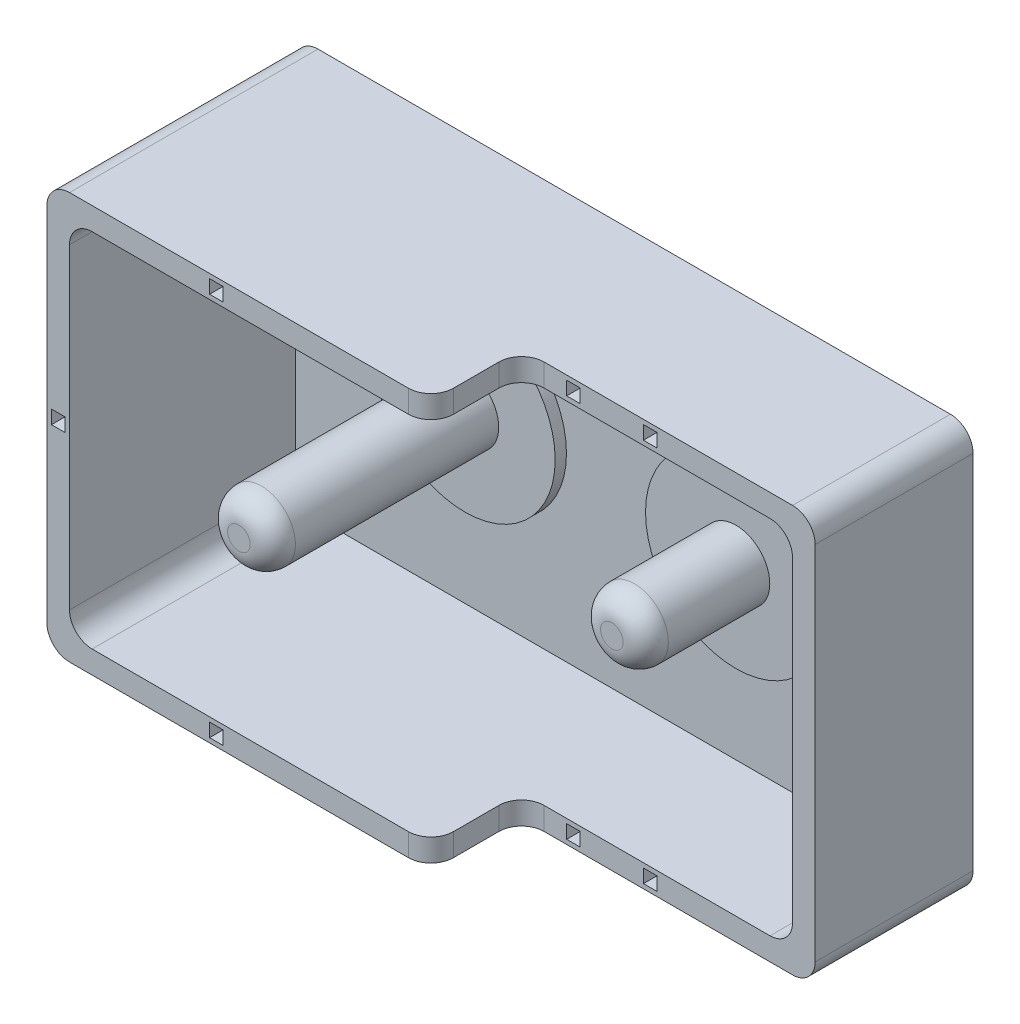
from build123d import *

# Parameters (mm, degrees)
SKETCH1_W           = 150
SKETCH1_H           = 90
BOSS_EXTRUDE1_DEPTH = 55
SHELL4_T            = -5
SKETCH2_R           = 20
BOSS_EXTRUDE2_DEPTH = 2.5
SKETCH3_R           = 7.5
BOSS_EXTRUDE3_DEPTH = 50
SKETCH4_W           = 65
SKETCH4_H           = 19.658499389
CUT_EXTRUDE1_DEPTH  = 185.136498283
SKETCH6_W           = 3
SKETCH6_H           = 3
CUT_EXTRUDE3_DEPTH  = 40
FILLET4_R           = 5
FILLET5_R           = 5
SKETCH10_W          = 3
SKETCH10_H          = 3
CUT_EXTRUDE4_DEPTH  = 40


with BuildPart() as part:
    # Sketch1 → Boss-Extrude1 (new body)
    with BuildSketch(Plane.XY):
        with Locations((75, -45)):
            Rectangle(SKETCH1_W, SKETCH1_H)
    extrude(amount=BOSS_EXTRUDE1_DEPTH)

    # Shell4
    shell4_openings = [part.faces().sort_by_distance(p)[0] for p in [
        (75, -45, 55),
    ]]
    offset(amount=SHELL4_T, openings=shell4_openings, kind=Kind.INTERSECTION)

    # Sketch2 → Boss-Extrude2 (add)
    with BuildSketch(Plane.XY.offset(5)):
        with Locations((45, -45)):
            Circle(SKETCH2_R)
        with Locations((105, -45)):
            Circle(SKETCH2_R)
    extrude(amount=BOSS_EXTRUDE2_DEPTH)

    # Sketch3 → Boss-Extrude3 (add)
    with BuildSketch(Plane.XY.offset(7.5)):
        with Locations((45, -45)):
            Circle(SKETCH3_R)
        with Locations((105, -45)):
            Circle(SKETCH3_R)
    extrude(amount=BOSS_EXTRUDE3_DEPTH)

    # Sketch4 → Cut-Extrude1 (cut, through all)
    with BuildSketch(Plane.XZ.offset(90)):
        Polygon((85, 55), (85, 49.954434269), (85, 34.954434269), (150, 34.954434269), (150, 55), align=None)
        with Locations((117.5, 64.829249694)):
            Rectangle(SKETCH4_W, SKETCH4_H)
    extrude(amount=-CUT_EXTRUDE1_DEPTH, mode=Mode.SUBTRACT)

    # Sketch6 → Cut-Extrude3 (cut)
    with BuildSketch(Plane.XY.offset(34.954434269)):
        with Locations((96.5, -2.5)):
            Rectangle(SKETCH6_W, SKETCH6_H)
        with Locations((113.5, -2.5)):
            Rectangle(SKETCH6_W, SKETCH6_H)
        with Locations((96.5, -87.5)):
            Rectangle(SKETCH6_W, SKETCH6_H)
        with Locations((113.5, -87.5)):
            Rectangle(SKETCH6_W, SKETCH6_H)
    extrude(amount=-CUT_EXTRUDE3_DEPTH, mode=Mode.SUBTRACT)

    # Fillet4
    fillet4_edges = [part.edges().sort_by_distance(p)[0] for p in [
        (5, -5, 30),
        (5, -85, 30),
        (145, -5, 19.977217134),
        (145, -85, 19.977217134),
        (150, 0, 17.477217134),
        (150, -90, 17.477217134),
        (85, -87.5, 55),
        (85, -87.5, 34.954434269),
        (85, -2.5, 55),
        (85, -2.5, 34.954434269),
        (0, 0, 27.5),
        (0, -90, 27.5),
    ]]
    fillet(fillet4_edges, radius=FILLET4_R)

    # Fillet5
    fillet5_edges = [part.edges().sort_by_distance(p)[0] for p in [
        (37.5, -45, 57.5),
        (97.5, -45, 34.954434269),
    ]]
    fillet(fillet5_edges, radius=FILLET5_R)

    # Sketch10 → Cut-Extrude4 (cut)
    with BuildSketch(Plane.XY.offset(55)):
        with Locations((2.5, -45)):
            Rectangle(SKETCH10_W, SKETCH10_H)
        with Locations((37.5, -87.5)):
            Rectangle(SKETCH10_W, SKETCH10_H)
        with Locations((37.5, -2.5)):
            Rectangle(SKETCH10_W, SKETCH10_H)
    extrude(amount=-CUT_EXTRUDE4_DEPTH, mode=Mode.SUBTRACT)


solid = part.part
